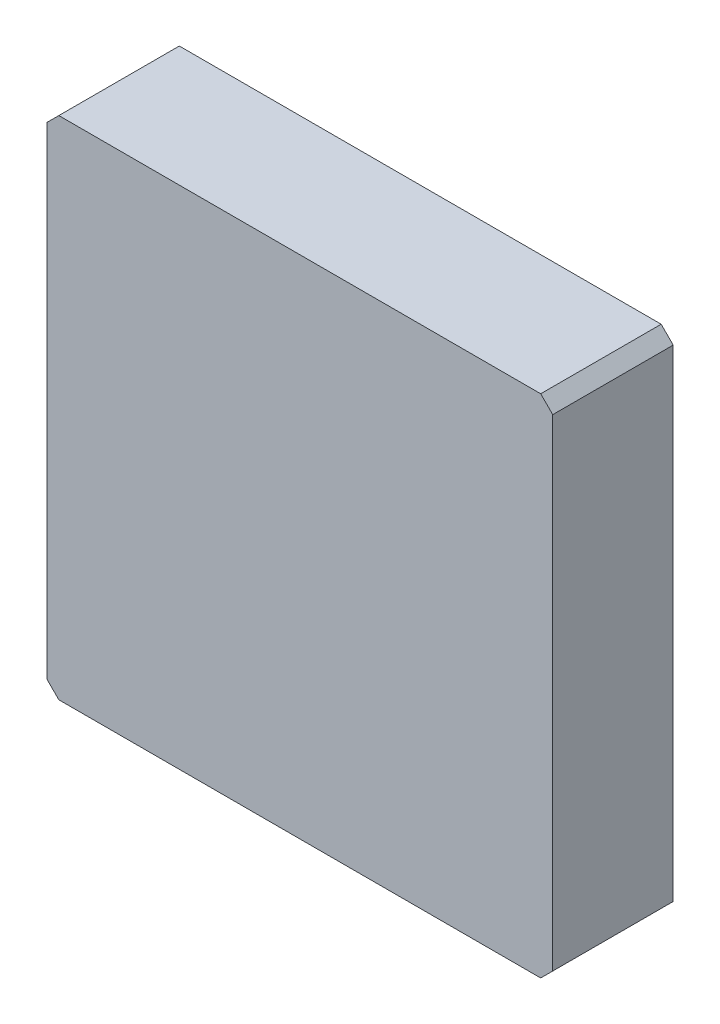
from build123d import *

# Parameters (mm, degrees)
BOSS_EXTRUDE1_DEPTH = 10


with BuildPart() as part:
    # Sketch1 → Boss-Extrude1 (new body)
    with BuildSketch(Plane.XY):
        Polygon((-21, 20), (-20, 21), (20, 21), (21, 20), (21, -20), (20, -21), (-20, -21), (-21, -20), align=None)
    extrude(amount=BOSS_EXTRUDE1_DEPTH)


solid = part.part
